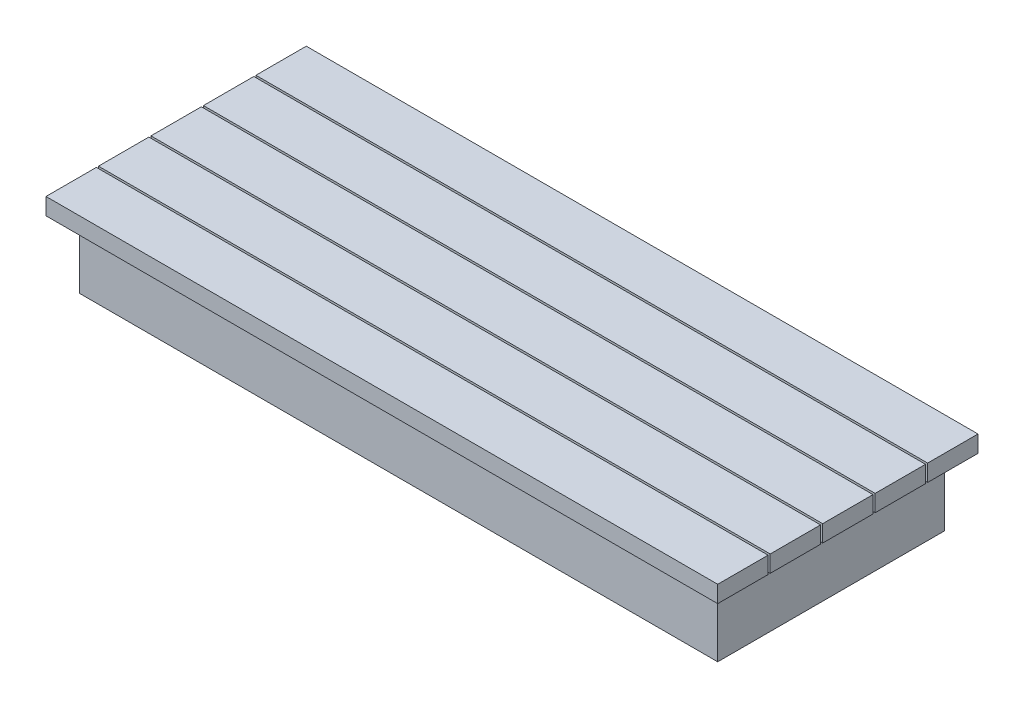
from build123d import *

# Parameters (mm, degrees)
SKETCH1_W             = 2032
SKETCH1_H             = 152.4
BOSS_EXTRUDE1_DEPTH   = 50.8
BOSS_EXTRUDE1_2_DEPTH = 50.8
BOSS_EXTRUDE1_3_DEPTH = 50.8
BOSS_EXTRUDE1_4_DEPTH = 50.8
BOSS_EXTRUDE1_5_DEPTH = 50.8
SKETCH2_W             = 1930.4
SKETCH2_H             = 685.8
SKETCH2_W_2           = 1828.8
SKETCH2_H_2           = 584.2
BOSS_EXTRUDE2_DEPTH   = 203.2


with BuildPart() as part:
    # Sketch1 → Boss-Extrude1 (new body)
    with BuildSketch(Plane(origin=(0, 0, 0), x_dir=(1, 0, 0), z_dir=(0, 1, 0))):
        Rectangle(SKETCH1_W, SKETCH1_H)
    extrude(amount=BOSS_EXTRUDE1_DEPTH)



with BuildPart() as body_2:
    # Sketch1 → Boss-Extrude1 2 (new body)
    with BuildSketch(Plane(origin=(0, 0, 0), x_dir=(1, 0, 0), z_dir=(0, 1, 0))):
        with Locations((0, 158.75)):
            Rectangle(SKETCH1_W, SKETCH1_H)
    extrude(amount=BOSS_EXTRUDE1_2_DEPTH)


with BuildPart() as body_3:
    # Sketch1 → Boss-Extrude1 3 (new body)
    with BuildSketch(Plane(origin=(0, 0, 0), x_dir=(1, 0, 0), z_dir=(0, 1, 0))):
        with Locations((0, 317.5)):
            Rectangle(SKETCH1_W, SKETCH1_H)
    extrude(amount=BOSS_EXTRUDE1_3_DEPTH)


with BuildPart() as body_4:
    # Sketch1 → Boss-Extrude1 4 (new body)
    with BuildSketch(Plane(origin=(0, 0, 0), x_dir=(1, 0, 0), z_dir=(0, 1, 0))):
        with Locations((0, -158.75)):
            Rectangle(SKETCH1_W, SKETCH1_H)
    extrude(amount=BOSS_EXTRUDE1_4_DEPTH)


with BuildPart() as body_5:
    # Sketch1 → Boss-Extrude1 5 (new body)
    with BuildSketch(Plane(origin=(0, 0, 0), x_dir=(1, 0, 0), z_dir=(0, 1, 0))):
        with Locations((0, -317.5)):
            Rectangle(SKETCH1_W, SKETCH1_H)
    extrude(amount=BOSS_EXTRUDE1_5_DEPTH)


with BuildPart() as part_1:
    add(part.part)

    add(body_2.part)  # Boss-Extrude2 merges body 2

    add(body_3.part)  # Boss-Extrude2 merges body 3

    add(body_4.part)  # Boss-Extrude2 merges body 4

    add(body_5.part)  # Boss-Extrude2 merges body 5
    # Sketch2 → Boss-Extrude2 (add)
    with BuildSketch(Plane(origin=(0, 0, 0), x_dir=(-1, 0, 0), z_dir=(0, -1, 0))):
        Rectangle(SKETCH2_W, SKETCH2_H)
        Rectangle(SKETCH2_W_2, SKETCH2_H_2, mode=Mode.SUBTRACT)
    extrude(amount=BOSS_EXTRUDE2_DEPTH)


solid = part_1.part
